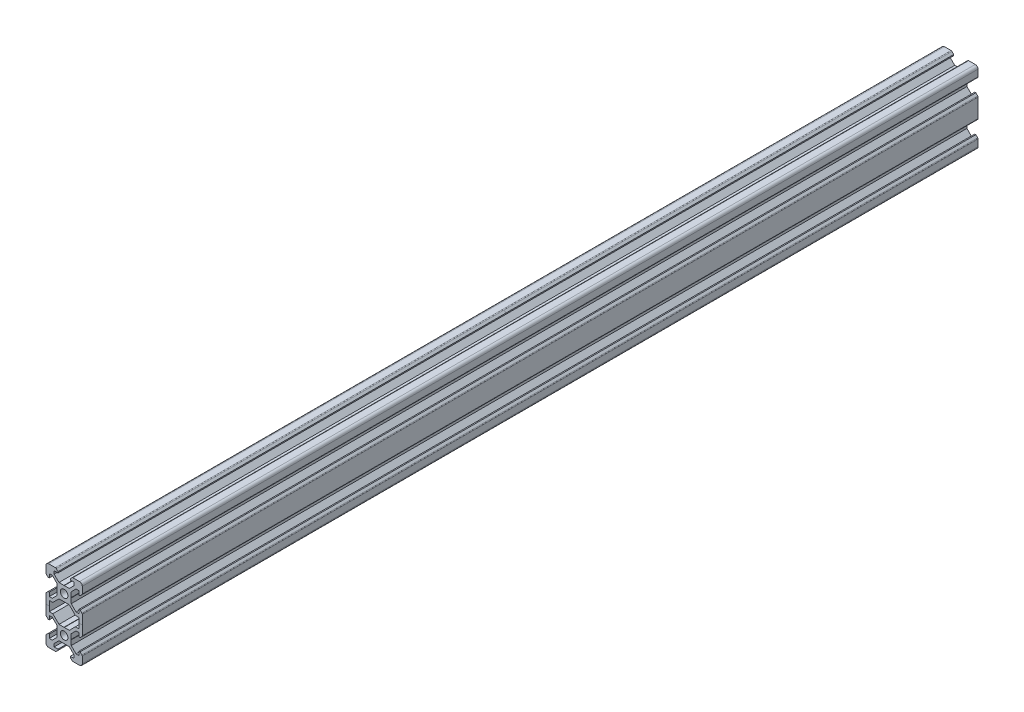
from build123d import *

# Parameters (mm, degrees)
SKETCH1_R           = 2.1
BOSS_EXTRUDE2_DEPTH = 494


with BuildPart() as part:
    # Sketch1 → Boss-Extrude2 (new body)
    with BuildSketch(Plane.XY):
        with BuildLine():
            Line((-8.5, 10), (-4.862792737, 10))
            ThreePointArc((-4.862792737, 10), (-4.598292737, 9.947387679), (-4.374060464, 9.797560464))
            Line((-4.374060464, 9.797560464), (-3.3865, 8.81))
            Line((-3.3865, 8.81), (-3.3865, 8.2))
            Line((-3.3865, 8.2), (-5.5, 8.2))
            Line((-5.5, 8.2), (-5.5, 6.561))
            Line((-5.5, 6.561), (-2.8395, 3.9005))
            Line((-2.8395, 3.9005), (-0.1, 3.9005))
            Line((-0.1, 3.9005), (0, 3.8005))
            Line((0, 3.8005), (0.1, 3.9005))
            Line((0.1, 3.9005), (2.8395, 3.9005))
            Line((2.8395, 3.9005), (5.5, 6.561))
            Line((5.5, 6.561), (5.5, 8.2))
            Line((5.5, 8.2), (3.3865, 8.2))
            Line((3.3865, 8.2), (3.3865, 8.81))
            Line((3.3865, 8.81), (4.374060464, 9.797560464))
            ThreePointArc((4.374060464, 9.797560464), (4.598292737, 9.947387679), (4.862792737, 10))
            Line((4.862792737, 10), (8.5, 10))
            ThreePointArc((8.5, 10), (9.560660172, 9.560660172), (10, 8.5))
            Line((10, 8.5), (10, 4.862792737))
            ThreePointArc((10, 4.862792737), (9.947387679, 4.598292737), (9.797560464, 4.374060464))
            Line((9.797560464, 4.374060464), (8.81, 3.3865))
            Line((8.81, 3.3865), (8.2, 3.3865))
            Line((8.2, 3.3865), (8.2, 5.5))
            Line((8.2, 5.5), (6.561, 5.5))
            Line((6.561, 5.5), (3.9005, 2.8395))
            Line((3.9005, 2.8395), (3.9005, 0.1))
            Line((3.9005, 0.1), (3.8005, 0))
            Line((3.8005, 0), (3.9005, -0.1))
            Line((3.9005, -0.1), (3.9005, -2.8395))
            Line((3.9005, -2.8395), (6.561, -5.5))
            Line((6.561, -5.5), (8.2, -5.5))
            Line((8.2, -5.5), (8.2, -3.3865))
            Line((8.2, -3.3865), (8.81, -3.3865))
            Line((8.81, -3.3865), (9.797560464, -4.374060464))
            ThreePointArc((9.797560464, -4.374060464), (9.947387679, -4.598292737), (10, -4.862792737))
            Line((10, -4.862792737), (10, -15.137207263))
            ThreePointArc((10, -15.137207263), (9.947387679, -15.401707263), (9.797560464, -15.625939536))
            Line((9.797560464, -15.625939536), (8.81, -16.6135))
            Line((8.81, -16.6135), (8.2, -16.6135))
            Line((8.2, -16.6135), (8.2, -14.5))
            Line((8.2, -14.5), (6.561, -14.5))
            Line((6.561, -14.5), (3.9005, -17.1605))
            Line((3.9005, -17.1605), (3.9005, -19.9))
            Line((3.9005, -19.9), (3.8005, -20))
            Line((3.8005, -20), (3.9005, -20.1))
            Line((3.9005, -20.1), (3.9005, -22.8395))
            Line((3.9005, -22.8395), (6.561, -25.5))
            Line((6.561, -25.5), (8.2, -25.5))
            Line((8.2, -25.5), (8.2, -23.3865))
            Line((8.2, -23.3865), (8.81, -23.3865))
            Line((8.81, -23.3865), (9.797560464, -24.374060464))
            ThreePointArc((9.797560464, -24.374060464), (9.947387679, -24.598292737), (10, -24.862792737))
            Line((10, -24.862792737), (10, -28.5))
            ThreePointArc((10, -28.5), (9.560660172, -29.560660172), (8.5, -30))
            Line((8.5, -30), (4.862792737, -30))
            ThreePointArc((4.862792737, -30), (4.598292737, -29.947387679), (4.374060464, -29.797560464))
            Line((4.374060464, -29.797560464), (3.3865, -28.81))
            Line((3.3865, -28.81), (3.3865, -28.2))
            Line((3.3865, -28.2), (5.5, -28.2))
            Line((5.5, -28.2), (5.5, -26.561))
            Line((5.5, -26.561), (2.8395, -23.9005))
            Line((2.8395, -23.9005), (0.1, -23.9005))
            Line((0.1, -23.9005), (0, -23.8005))
            Line((0, -23.8005), (-0.1, -23.9005))
            Line((-0.1, -23.9005), (-2.8395, -23.9005))
            Line((-2.8395, -23.9005), (-5.5, -26.561))
            Line((-5.5, -26.561), (-5.5, -28.2))
            Line((-5.5, -28.2), (-3.3865, -28.2))
            Line((-3.3865, -28.2), (-3.3865, -28.81))
            Line((-3.3865, -28.81), (-4.374060464, -29.797560464))
            ThreePointArc((-4.374060464, -29.797560464), (-4.598292737, -29.947387679), (-4.862792737, -30))
            Line((-4.862792737, -30), (-8.5, -30))
            ThreePointArc((-8.5, -30), (-9.560660172, -29.560660172), (-10, -28.5))
            Line((-10, -28.5), (-10, -24.862792737))
            ThreePointArc((-10, -24.862792737), (-9.947387679, -24.598292737), (-9.797560464, -24.374060464))
            Line((-9.797560464, -24.374060464), (-8.81, -23.3865))
            Line((-8.81, -23.3865), (-8.2, -23.3865))
            Line((-8.2, -23.3865), (-8.2, -25.5))
            Line((-8.2, -25.5), (-6.561, -25.5))
            Line((-6.561, -25.5), (-3.9005, -22.8395))
            Line((-3.9005, -22.8395), (-3.9005, -20.1))
            Line((-3.9005, -20.1), (-3.8005, -20))
            Line((-3.8005, -20), (-3.9005, -19.9))
            Line((-3.9005, -19.9), (-3.9005, -17.1605))
            Line((-3.9005, -17.1605), (-6.561, -14.5))
            Line((-6.561, -14.5), (-8.2, -14.5))
            Line((-8.2, -14.5), (-8.2, -16.6135))
            Line((-8.2, -16.6135), (-8.81, -16.6135))
            Line((-8.81, -16.6135), (-9.797560464, -15.625939536))
            ThreePointArc((-9.797560464, -15.625939536), (-9.947387679, -15.401707263), (-10, -15.137207263))
            Line((-10, -15.137207263), (-10, -4.862792737))
            ThreePointArc((-10, -4.862792737), (-9.947387679, -4.598292737), (-9.797560464, -4.374060464))
            Line((-9.797560464, -4.374060464), (-8.81, -3.3865))
            Line((-8.81, -3.3865), (-8.2, -3.3865))
            Line((-8.2, -3.3865), (-8.2, -5.5))
            Line((-8.2, -5.5), (-6.561, -5.5))
            Line((-6.561, -5.5), (-3.9005, -2.8395))
            Line((-3.9005, -2.8395), (-3.9005, -0.1))
            Line((-3.9005, -0.1), (-3.8005, 0))
            Line((-3.8005, 0), (-3.9005, 0.1))
            Line((-3.9005, 0.1), (-3.9005, 2.8395))
            Line((-3.9005, 2.8395), (-6.561, 5.5))
            Line((-6.561, 5.5), (-8.2, 5.5))
            Line((-8.2, 5.5), (-8.2, 3.3865))
            Line((-8.2, 3.3865), (-8.81, 3.3865))
            Line((-8.81, 3.3865), (-9.797560464, 4.374060464))
            ThreePointArc((-9.797560464, 4.374060464), (-9.947387679, 4.598292737), (-10, 4.862792737))
            Line((-10, 4.862792737), (-10, 8.5))
            ThreePointArc((-10, 8.5), (-9.560660172, 9.560660172), (-8.5, 10))
        make_face()
        Circle(SKETCH1_R, mode=Mode.SUBTRACT)
        with Locations((0, -20)):
            Circle(SKETCH1_R, mode=Mode.SUBTRACT)
        Polygon((-8.2, -12.7), (-8.2, -7.3), (-6.239, -7.3), (-5.5, -6.561), (-2.8395, -3.9005), (-0.1, -3.9005), (0, -3.8005), (0.1, -3.9005), (2.8395, -3.9005), (5.5, -6.561), (6.239, -7.3), (8.2, -7.3), (8.2, -12.7), (6.239, -12.7), (5.5, -13.439), (2.8395, -16.0995), (0.1, -16.0995), (0, -16.1995), (-0.1, -16.0995), (-2.8395, -16.0995), (-5.5, -13.439), (-6.239, -12.7), align=None, mode=Mode.SUBTRACT)
    extrude(amount=BOSS_EXTRUDE2_DEPTH)


solid = part.part
